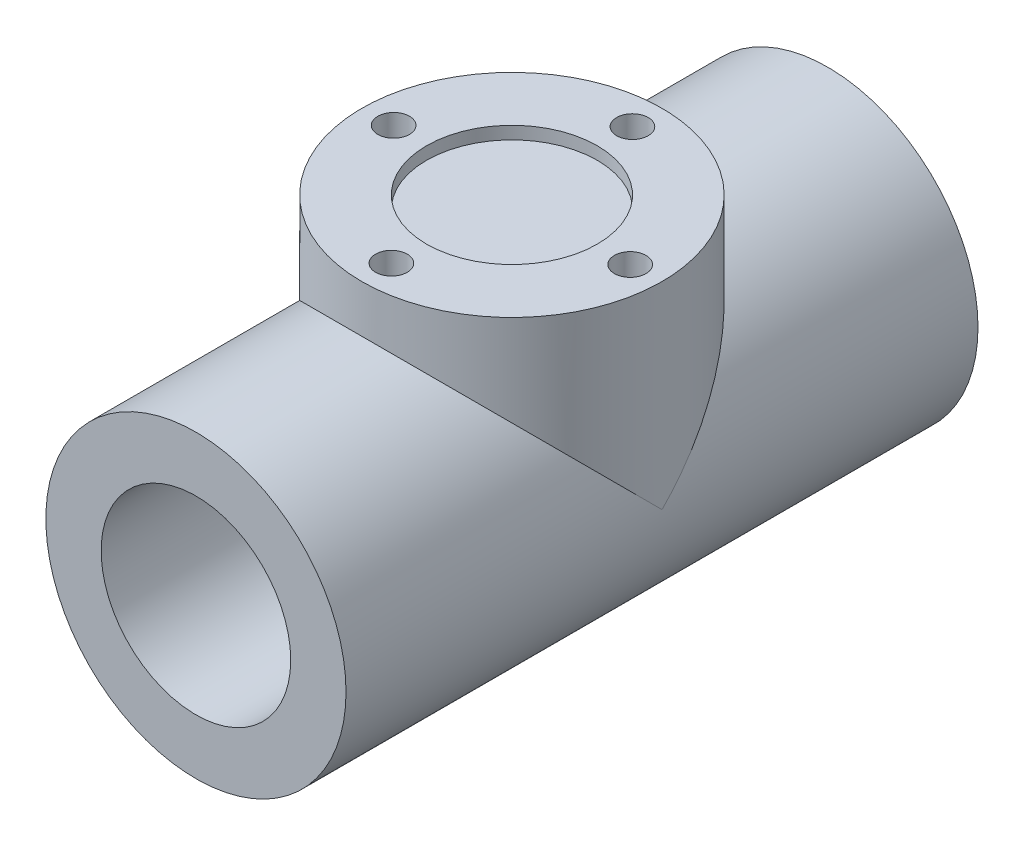
from build123d import *

# Parameters (mm, degrees)
SKETCH1_R           = 47.5
SKETCH1_R_2         = 30
BOSS_EXTRUDE1_DEPTH = 200
SKETCH2_R           = 47.5
BOSS_EXTRUDE2_DEPTH = 62.5
SKETCH3_R           = 27
CUT_EXTRUDE1_DEPTH  = 4
CIRPATTERN1_COUNT   = 4


with BuildPart() as part:
    # Sketch1 → Boss-Extrude1 (new body)
    with BuildSketch(Plane.XY):
        Circle(SKETCH1_R)
        Circle(SKETCH1_R_2, mode=Mode.SUBTRACT)
    extrude(amount=BOSS_EXTRUDE1_DEPTH)

    # Sketch2 → Boss-Extrude2 (add)
    with BuildSketch(Plane(origin=(0, 62.5, 0), x_dir=(1, 0, 0), z_dir=(0, 1, 0))):
        with Locations(Location((0, -100, 0), (0, 0, 270))):
            Circle(SKETCH2_R)
    extrude(amount=-BOSS_EXTRUDE2_DEPTH)

    # Sketch3 → Cut-Extrude1 (cut)
    with BuildSketch(Plane(origin=(0, 62.5, 0), x_dir=(1, 0, 0), z_dir=(0, 1, 0))):
        with Locations(Location((0, -100, 0), (0, 0, 270))):
            Circle(SKETCH3_R)
    extrude(amount=-CUT_EXTRUDE1_DEPTH, mode=Mode.SUBTRACT)

    # Sketch6 → Ø1.0mm Dowel Hole1 (revolve, cut)
    with BuildSketch(Plane(origin=(0.350654227, 62.5, 62.212739692), x_dir=(0, 0, 1), z_dir=(1, 0, 0))):
        Polygon((0, 0), (0, 23.004303095), (5, 20), (5, 0), align=None)
    f_1_0mm_dowel_hole1 = revolve(axis=Axis((0.350654227, 68.85, 62.212739692), (0, -1, 0)), mode=Mode.SUBTRACT)

    # CirPattern1: Ø1.0mm Dowel Hole1 ×4 about axis
    cirpattern1_axis = Axis((0, 0, 100), (0, 1, 0))
    for i in range(1, CIRPATTERN1_COUNT):
        add(f_1_0mm_dowel_hole1.rotate(cirpattern1_axis, i * 360 / CIRPATTERN1_COUNT), mode=Mode.SUBTRACT)


solid = part.part
